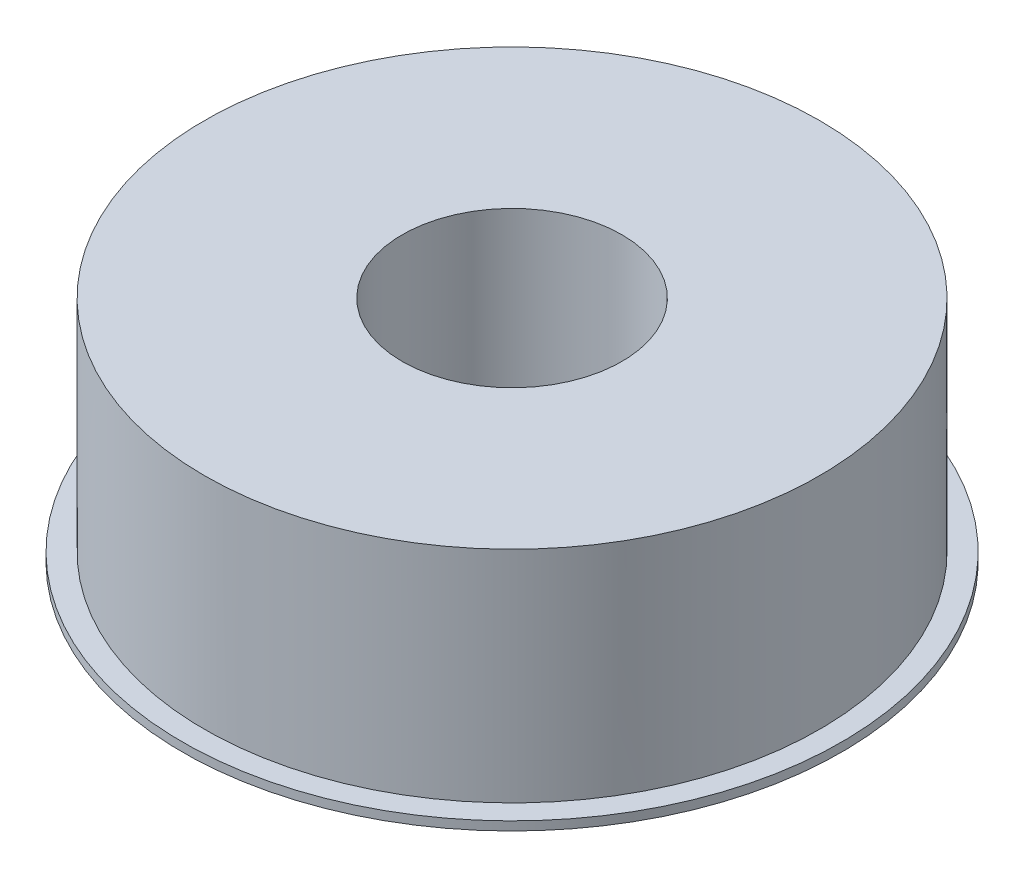
from build123d import *

# Parameters (mm, degrees)
SKETCH_1_R          = 7
EXTRUDE_1_DEPTH     = 5
SKETCH_3_R          = 7.5
EXTRUDE_2_DEPTH     = 0.2
SKETCH_4_R          = 2.5
CUT_EXTRUDE_2_DEPTH = 10


with BuildPart() as part:
    # 草图1 → 凸台-拉伸1 (new body)
    with BuildSketch(Plane(origin=(0, 0, 0), x_dir=(1, 0, 0), z_dir=(0, 1, 0))):
        with Locations(Location((0, 0, 0), (0, 0, 270))):
            Circle(SKETCH_1_R)
    extrude(amount=EXTRUDE_1_DEPTH)

    # 草图3 → 凸台-拉伸2 (add)
    with BuildSketch(Plane.XZ):
        with Locations(Location((0, 0, 0), (0, 0, 270))):
            Circle(SKETCH_3_R)
    extrude(amount=EXTRUDE_2_DEPTH)

    # 草图4 → 切除-拉伸2 (cut)
    with BuildSketch(Plane(origin=(0, 5, 0), x_dir=(1, 0, 0), z_dir=(0, 1, 0))):
        with Locations(Location((0, 0, 0), (0, 0, 270))):
            Circle(SKETCH_4_R)
    extrude(amount=-CUT_EXTRUDE_2_DEPTH, mode=Mode.SUBTRACT)


solid = part.part
